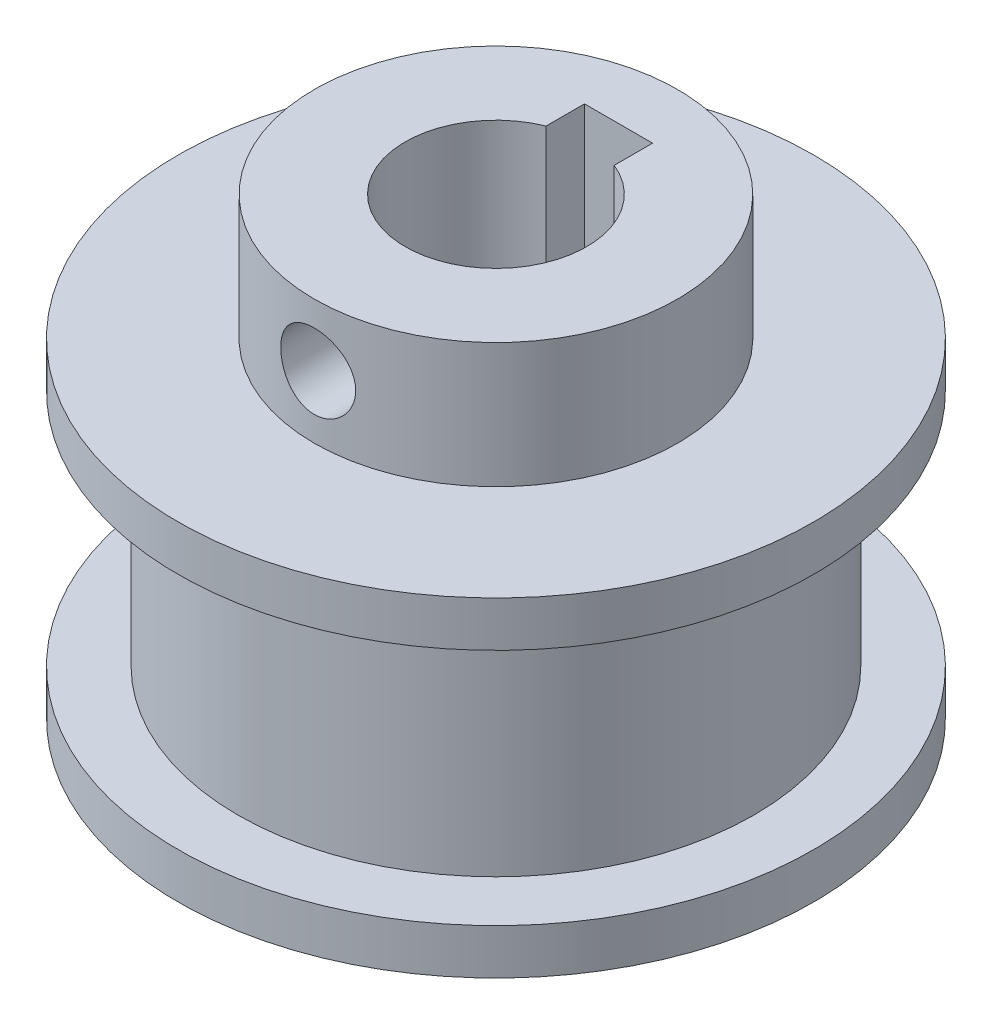
from build123d import *

# Parameters (mm, degrees)
SKETCH1_R             = 14
BOSS_EXTRUDE1_DEPTH   = 14.5
SKETCH2_R             = 8
BOSS_EXTRUDE2_DEPTH   = 5.5
SKETCH3_W             = 5.27
SKETCH3_H             = 10.5
SKETCH4_R             = 4
CUT_EXTRUDE1_DEPTH    = 29.142494559
SKETCH5_W             = 3
SKETCH5_H             = 2.8
CUT_EXTRUDE2_DEPTH    = 29.142494559
M4_TAPPED_HOLE1_D     = 3.3
M4_TAPPED_HOLE1_DEPTH = 5
M4_TAPPED_HOLE1_TIP   = 0.991420021


with BuildPart() as part:
    # Sketch1 → Boss-Extrude1 (new body)
    with BuildSketch(Plane(origin=(0, 0, 0), x_dir=(1, 0, 0), z_dir=(0, 1, 0))):
        with Locations(Location((0, 0, 0), (0, 0, 90))):
            Circle(SKETCH1_R)
    extrude(amount=BOSS_EXTRUDE1_DEPTH)

    # Sketch2 → Boss-Extrude2 (add)
    with BuildSketch(Plane(origin=(0, 14.5, 0), x_dir=(1, 0, 0), z_dir=(0, 1, 0))):
        with Locations(Location((0, 0, 0), (0, 0, 270))):
            Circle(SKETCH2_R)
    extrude(amount=BOSS_EXTRUDE2_DEPTH)

    # Sketch3 → Cut-Revolve1 (revolve, cut)
    with BuildSketch(Plane(origin=(0, 0, 0), x_dir=(0, 0, -1), z_dir=(1, 0, 0)), mode=Mode.PRIVATE) as cut_revolve1_sk:
        with Locations((-14, 7.25)):
            Rectangle(SKETCH3_W, SKETCH3_H)
    revolve(cut_revolve1_sk.sketch.rotate(Axis((0, 14.5, 0), (0, -1, 0)), 180), axis=Axis((0, 14.5, 0), (0, -1, 0)), mode=Mode.SUBTRACT)

    # Sketch4 → Cut-Extrude1 (cut, through all)
    with BuildSketch(Plane(origin=(0, 20, 0), x_dir=(1, 0, 0), z_dir=(0, 1, 0))):
        with Locations(Location((0, 0, 0), (0, 0, 270))):
            Circle(SKETCH4_R)
    extrude(amount=-CUT_EXTRUDE1_DEPTH, mode=Mode.SUBTRACT)

    # Sketch5 → Cut-Extrude2 (cut, through all)
    with BuildSketch(Plane(origin=(0, 20, 0), x_dir=(1, 0, 0), z_dir=(0, 1, 0))):
        with Locations((0, 4)):
            Rectangle(SKETCH5_W, SKETCH5_H)
    extrude(amount=-CUT_EXTRUDE2_DEPTH, mode=Mode.SUBTRACT)

    # M4 Tapped Hole1
    with Locations(Plane(origin=(0, 17.25, 8), x_dir=(1, 0, 0), z_dir=(0, 0, 1))):
        with Locations((0, 0)):
            Hole(M4_TAPPED_HOLE1_D / 2, depth=M4_TAPPED_HOLE1_DEPTH)
            with Locations((0, 0, -(M4_TAPPED_HOLE1_DEPTH + M4_TAPPED_HOLE1_TIP / 2))):  # 118° drill point
                Cone(0, M4_TAPPED_HOLE1_D / 2, M4_TAPPED_HOLE1_TIP, mode=Mode.SUBTRACT)


solid = part.part
